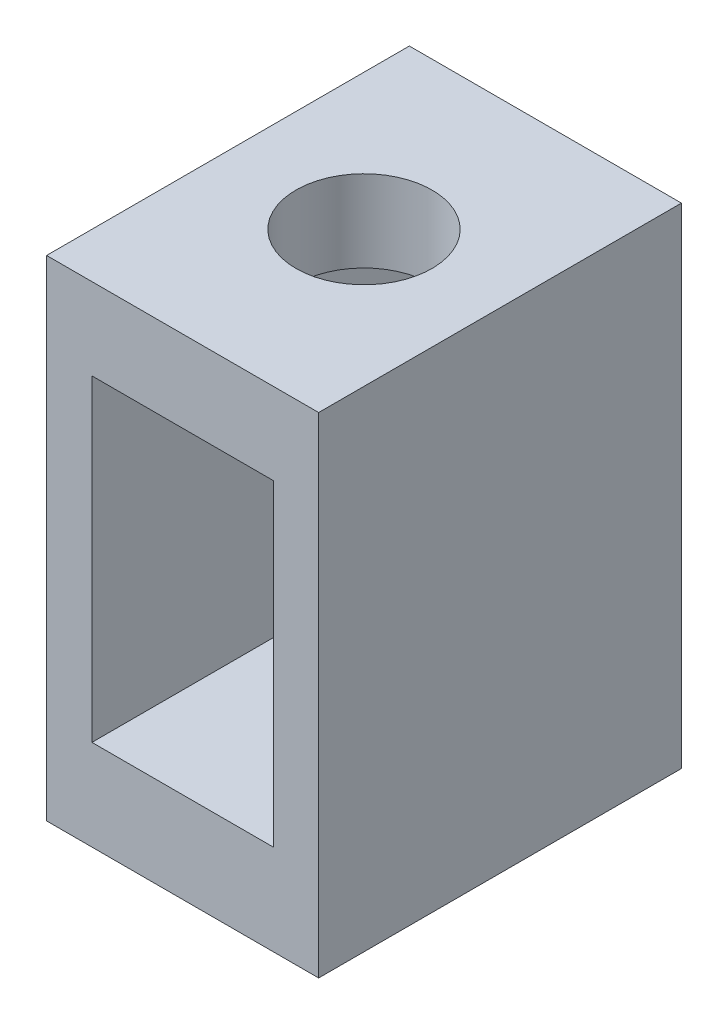
from build123d import *

# Parameters (mm, degrees)
SKETCH_1_W          = 3
SKETCH_1_H          = 5.4
EXTRUDE_1_DEPTH     = 4
SKETCH_2_W          = 2
SKETCH_2_H          = 3.5
CUT_EXTRUDE_1_DEPTH = 6.053711507
CUT_EXTRUDE_2_REACH = 8.885
SKETCH_3_R          = 0.75


with BuildPart() as part:
    # Эскиз1 → Бобышка-Вытянуть1 (new body)
    with BuildSketch(Plane.XY):
        Rectangle(SKETCH_1_W, SKETCH_1_H)
    extrude(amount=-EXTRUDE_1_DEPTH)

    # Эскиз2 → Вырез-Вытянуть1 (cut, through all)
    with BuildSketch(Plane.XY):
        with Locations((0, 0.05)):
            Rectangle(SKETCH_2_W, SKETCH_2_H)
    extrude(amount=-CUT_EXTRUDE_1_DEPTH, mode=Mode.SUBTRACT)

    # Эскиз3 → Вырез-Вытянуть2 (cut, up to next)
    with BuildSketch(Plane(origin=(0, 2.7, 0), x_dir=(1, 0, 0), z_dir=(0, 1, 0)), mode=Mode.PRIVATE) as cut_extrude_2_sk1:
        with Locations(Location((0, 2, 0), (0, 0, 270))):
            Circle(SKETCH_3_R)
    cut_extrude_2_tool1 = extrude(cut_extrude_2_sk1.sketch, amount=-CUT_EXTRUDE_2_REACH, mode=Mode.PRIVATE) & part.part
    add(cut_extrude_2_tool1.solids().sort_by_distance((0, 2.7, -2))[0], mode=Mode.SUBTRACT)


solid = part.part
